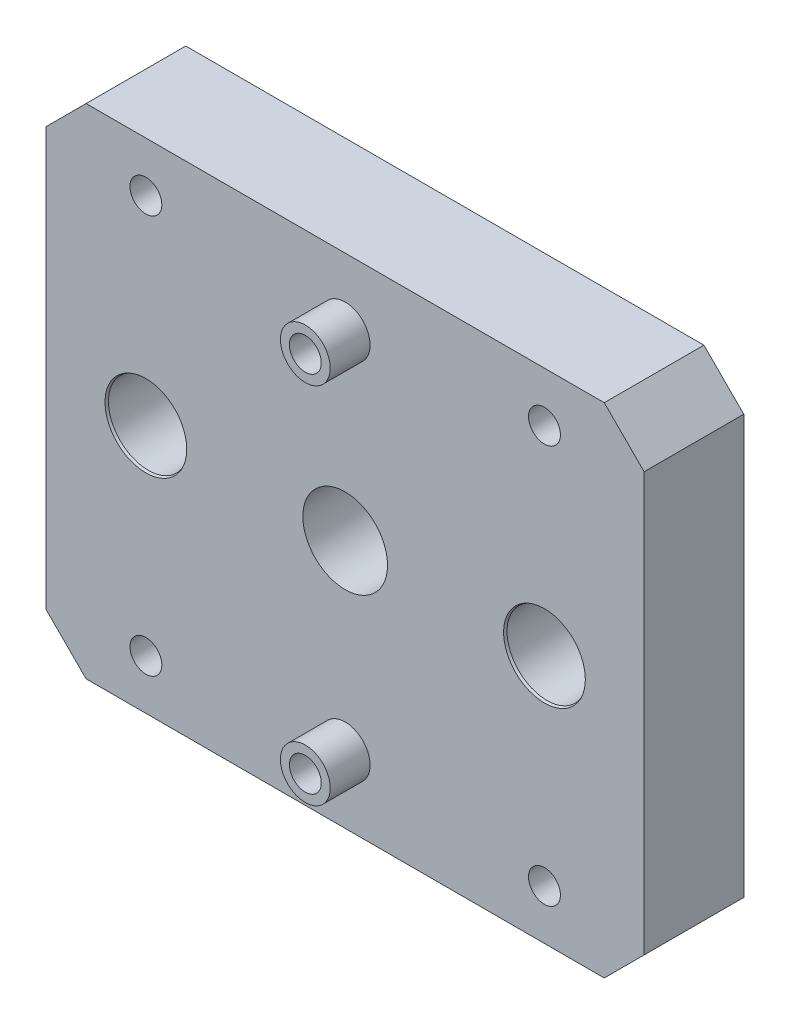
from build123d import *

# Parameters (mm, degrees)
SKETCH_1_W                = 60
SKETCH_1_H                = 50
EXTRUDE_1_DEPTH           = 10
HOLE_WIZARD_1_D           = 8.5
HOLE_WIZARD_1_DEPTH       = 20
HOLE_WIZARD_2_D           = 8
HOLE_WIZARD_2_CSINK_D     = 8.2
HOLE_WIZARD_2_CSINK_ANGLE = 45
SKETCH_9_R                = 2.5
EXTRUDE_3_DEPTH           = 4
HOLE_WIZARD_3_D           = 3.2
CHAMFER_1_SIZE            = 4
SKETCH_15_R               = 1.6
CUT_EXTRUDE_1_DEPTH       = 41.311288741


with BuildPart() as part:
    # 草图1 → 凸台-拉伸1 (new body)
    with BuildSketch(Plane.XY):
        Rectangle(SKETCH_1_W, SKETCH_1_H)
    extrude(amount=EXTRUDE_1_DEPTH)

    # 孔1
    with Locations(Plane.XY.offset(10)):
        with Locations((0, 0)):
            Hole(HOLE_WIZARD_1_D / 2, depth=HOLE_WIZARD_1_DEPTH)

    # 孔2 (through all)
    with Locations(Plane.XY.offset(10)):
        with Locations((20, 0), (-20, 0)):
            CounterSinkHole(HOLE_WIZARD_2_D / 2, HOLE_WIZARD_2_CSINK_D / 2, counter_sink_angle=HOLE_WIZARD_2_CSINK_ANGLE)

    # 草图9 → 凸台-拉伸3 (add)
    with BuildSketch(Plane.XY.offset(10)):
        with Locations(Location((0, 18.25, 0), (0, 0, 180))):
            Circle(SKETCH_9_R)
        with Locations(Location((0, -18.25, 0), (0, 0, 180))):
            Circle(SKETCH_9_R)
    extrude(amount=EXTRUDE_3_DEPTH)

    # 孔3 (through all)
    with Locations(Plane.XY.offset(14)):
        with Locations((0, 18.25), (0, -18.25)):
            Hole(HOLE_WIZARD_3_D / 2)

    # 倒角1
    chamfer_1_edges = [part.edges().sort_by_distance(p)[0] for p in [
        (30, -25, 5),
        (-30, -25, 5),
        (-30, 25, 5),
        (30, 25, 5),
    ]]
    chamfer(chamfer_1_edges, length=CHAMFER_1_SIZE)

    # 草图15 → 切除-拉伸1 (cut, through all)
    with BuildSketch(Plane.XY.offset(10)):
        with BuildLine():
            ThreePointArc((-21.13137085, 21.13137085), (-21.13137085, 18.86862915), (-18.86862915, 18.86862915))
            Line((-18.86862915, 18.86862915), (-21.13137085, 21.13137085))
        make_face()
        with BuildLine():
            Line((-21.13137085, 21.13137085), (-18.86862915, 18.86862915))
            ThreePointArc((-18.86862915, 18.86862915), (-18.521792748, 19.387706508), (-18.4, 20))
            ThreePointArc((-18.4, 20), (-19.387706508, 21.478207252), (-21.13137085, 21.13137085))
        make_face()
        with Locations((20, 20)):
            Circle(SKETCH_15_R)
        with Locations((20, -20)):
            Circle(SKETCH_15_R)
        with Locations(Location((-20, -20, 0), (0, 0, 180))):
            Circle(SKETCH_15_R)
    extrude(amount=-CUT_EXTRUDE_1_DEPTH, mode=Mode.SUBTRACT)


solid = part.part
